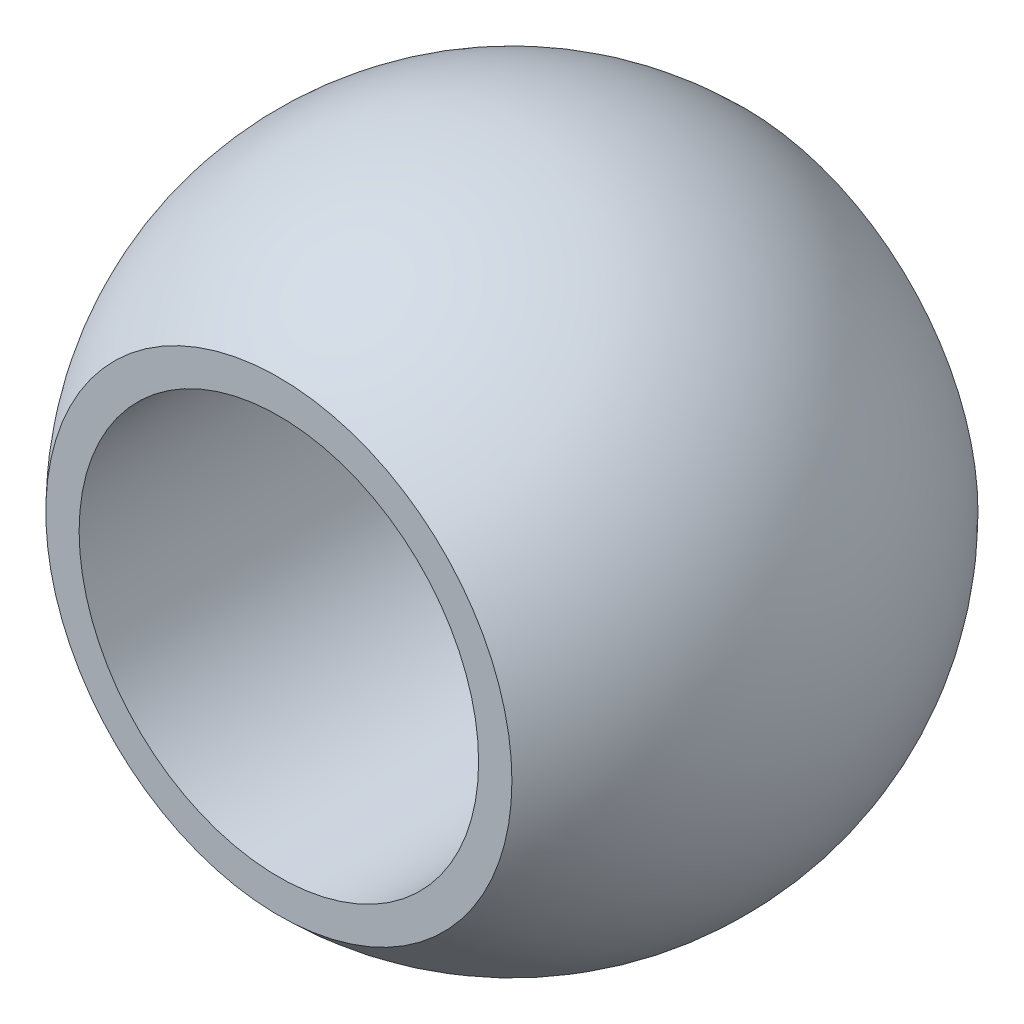
from build123d import *

# Parameters (mm, degrees)
CUT_EXTRUDE1_DEPTH      = 22
CUT_EXTRUDE1_DEPTH_BACK = 22
SKETCH2_R               = 6
CUT_EXTRUDE2_DEPTH      = 10
CUT_EXTRUDE2_DEPTH_BACK = 10
SKETCH3_W               = 22.544434573
SKETCH3_H               = 3.299731411
SKETCH3_W_2             = 22.548164644
SKETCH3_H_2             = 2.749776176


with BuildPart() as part:
    # Sketch1 → Revolve1 (revolve)
    with BuildSketch(Plane.XY):
        with BuildLine():
            Line((0, 9.9), (0, -9.9))
            ThreePointArc((0, -9.9), (9.9, 0), (0, 9.9))
        make_face()
    revolve(axis=Axis((0, 9.9, 0), (0, -1, 0)))

    # Sketch2 → Cut-Extrude1 (cut, two sides: drawn at the far end of the back side and taken through both)
    with BuildSketch(Plane.XY.offset(-CUT_EXTRUDE1_DEPTH_BACK)):
        Circle(SKETCH2_R)
    extrude(amount=CUT_EXTRUDE1_DEPTH + CUT_EXTRUDE1_DEPTH_BACK, mode=Mode.SUBTRACT)

    # Sketch3 → Cut-Extrude2 (cut, two sides: drawn at the far end of the back side and taken through both)
    with BuildSketch(Plane(origin=(0, 0, 0), x_dir=(1, 0, 0), z_dir=(0, 1, 0)).offset(-CUT_EXTRUDE2_DEPTH_BACK)):
        with Locations((0.185183448, 8.649865705)):
            Rectangle(SKETCH3_W, SKETCH3_H)
        with Locations((0.183318412, -8.374888088)):
            Rectangle(SKETCH3_W_2, SKETCH3_H_2)
    extrude(amount=CUT_EXTRUDE2_DEPTH + CUT_EXTRUDE2_DEPTH_BACK, mode=Mode.SUBTRACT)


solid = part.part
